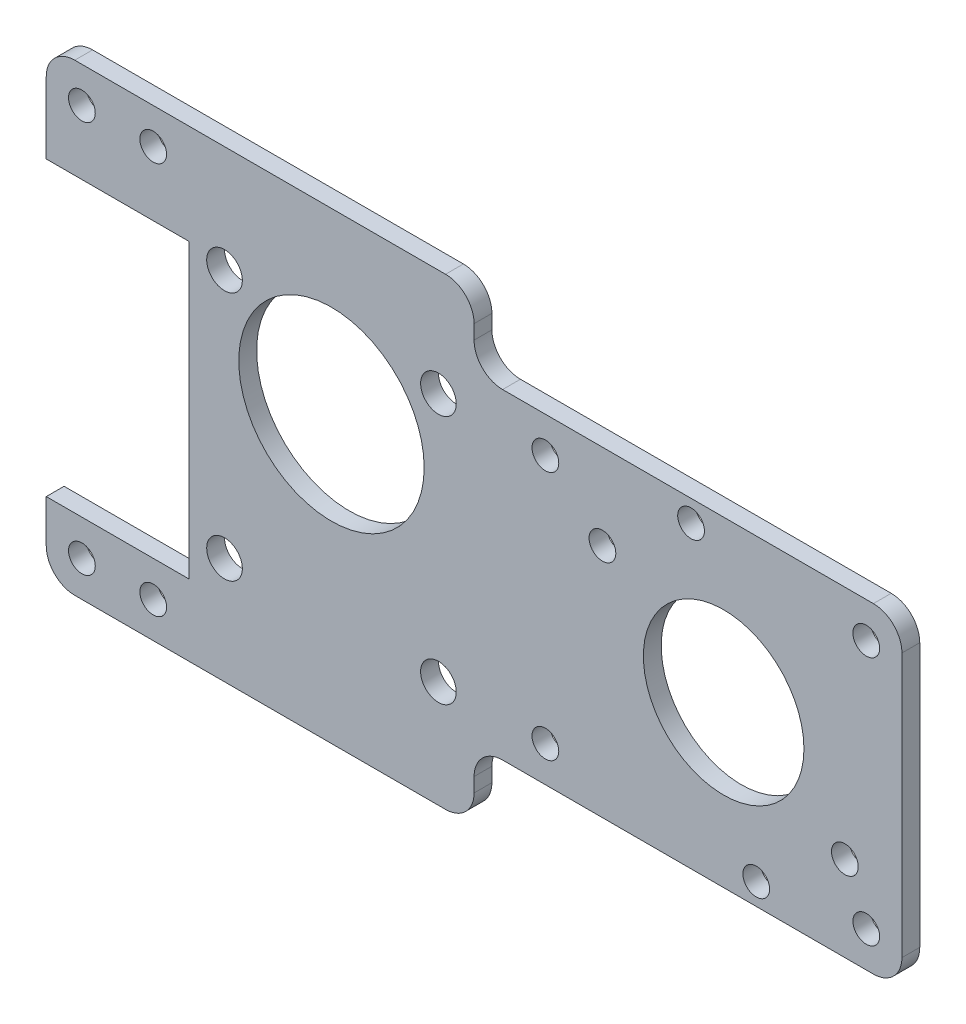
from build123d import *

# Parameters (mm, degrees)
SKETCH1_W           = 127
SKETCH1_H           = 57.15
SKETCH1_R           = 14.3002
SKETCH1_R_2         = 2.38125
BOSS_EXTRUDE1_DEPTH = 3.175
SKETCH2_R           = 2.38125
CUT_EXTRUDE1_DEPTH  = 3.175
FILLET1_R           = 5.08
SKETCH3_R           = 3.175
CUT_EXTRUDE2_DEPTH  = 3.175
SKETCH4_R           = 16.51
CUT_EXTRUDE3_DEPTH  = 7.62
SKETCH5_W           = 76.2
SKETCH5_H           = 12.7
BOSS_EXTRUDE2_DEPTH = 3.175
FILLET2_R           = 5.08
SKETCH6_W           = 25.4
SKETCH6_H           = 5.08
BOSS_EXTRUDE3_DEPTH = 3.175
FILLET3_R           = 5.08
SKETCH7_R           = 2.38125
CUT_EXTRUDE4_DEPTH  = 3.175


with BuildPart() as part:
    # Sketch1 → Boss-Extrude1 (new body)
    with BuildSketch(Plane.XY):
        Rectangle(SKETCH1_W, SKETCH1_H)
        with Locations((31.75, 0)):
            Circle(SKETCH1_R, mode=Mode.SUBTRACT)
        with Locations((37.555148495, -24.727722316)):
            Circle(SKETCH1_R_2, mode=Mode.SUBTRACT)
        with Locations((10.16, 13.380280266)):
            Circle(SKETCH1_R_2, mode=Mode.SUBTRACT)
        with Locations((25.944851505, 24.727722316)):
            Circle(SKETCH1_R_2, mode=Mode.SUBTRACT)
        with Locations((53.34, -13.380280266)):
            Circle(SKETCH1_R_2, mode=Mode.SUBTRACT)
    extrude(amount=BOSS_EXTRUDE1_DEPTH)

    # Sketch2 → Cut-Extrude1 (cut)
    with BuildSketch(Plane.XY.offset(3.175)):
        with Locations((57.15, 22.225)):
            Circle(SKETCH2_R)
        with Locations((57.15, -22.225)):
            Circle(SKETCH2_R)
        with Locations((0, 22.225)):
            Circle(SKETCH2_R)
        with Locations((0, -22.225)):
            Circle(SKETCH2_R)
    extrude(amount=-CUT_EXTRUDE1_DEPTH, mode=Mode.SUBTRACT)

    # Fillet1
    fillet1_edges = [part.edges().sort_by_distance(p)[0] for p in [
        (63.5, -28.575, 1.5875),
        (63.5, 28.575, 1.5875),
    ]]
    fillet(fillet1_edges, radius=FILLET1_R)

    # Sketch3 → Cut-Extrude2 (cut)
    with BuildSketch(Plane.XY.offset(3.175)):
        with Locations((-57.15, 22.225)):
            Circle(SKETCH3_R)
        with Locations((-19.05, 22.225)):
            Circle(SKETCH3_R)
        with Locations(Location((-19.05, -22.225, 0), (0, 0, 180))):
            Circle(SKETCH3_R)
        with Locations(Location((-57.15, -22.225, 0), (0, 0, 180))):
            Circle(SKETCH3_R)
    extrude(amount=-CUT_EXTRUDE2_DEPTH, mode=Mode.SUBTRACT)

    # Sketch4 → Cut-Extrude3 (cut)
    with BuildSketch(Plane.XY.offset(3.175)):
        with Locations((-38.1, 9.525)):
            Circle(SKETCH4_R)
    extrude(amount=-CUT_EXTRUDE3_DEPTH, mode=Mode.SUBTRACT)

    # Sketch5 → Boss-Extrude2 (add)
    with BuildSketch(Plane.XY.offset(3.175)):
        with Locations((-50.8, -34.925)):
            Rectangle(SKETCH5_W, SKETCH5_H)
        with Locations((-50.8, 34.925)):
            Rectangle(SKETCH5_W, SKETCH5_H)
    extrude(amount=-BOSS_EXTRUDE2_DEPTH)

    # Fillet2
    fillet2_edges = [part.edges().sort_by_distance(p)[0] for p in [
        (-12.7, 41.275, 1.5875),
        (-12.7, 28.575, 1.5875),
        (-12.7, -28.575, 1.5875),
        (-12.7, -41.275, 1.5875),
    ]]
    fillet(fillet2_edges, radius=FILLET2_R)

    # Sketch6 → Boss-Extrude3 (add)
    with BuildSketch(Plane.XY.offset(3.175)):
        with Locations((-76.2, 26.035)):
            Rectangle(SKETCH6_W, SKETCH6_H)
    extrude(amount=-BOSS_EXTRUDE3_DEPTH)

    # Fillet3
    fillet3_edges = [part.edges().sort_by_distance(p)[0] for p in [
        (-88.9, 41.275, 1.5875),
        (-88.9, -41.275, 1.5875),
    ]]
    fillet(fillet3_edges, radius=FILLET3_R)

    # Sketch7 → Cut-Extrude4 (cut)
    with BuildSketch(Plane.XY.offset(3.175)):
        with Locations((-82.55, 34.925)):
            Circle(SKETCH7_R)
        with Locations((-82.55, -34.925)):
            Circle(SKETCH7_R)
        with Locations((-69.85, 34.925)):
            Circle(SKETCH7_R)
        with Locations((-69.85, -34.925)):
            Circle(SKETCH7_R)
    extrude(amount=-CUT_EXTRUDE4_DEPTH, mode=Mode.SUBTRACT)


solid = part.part
